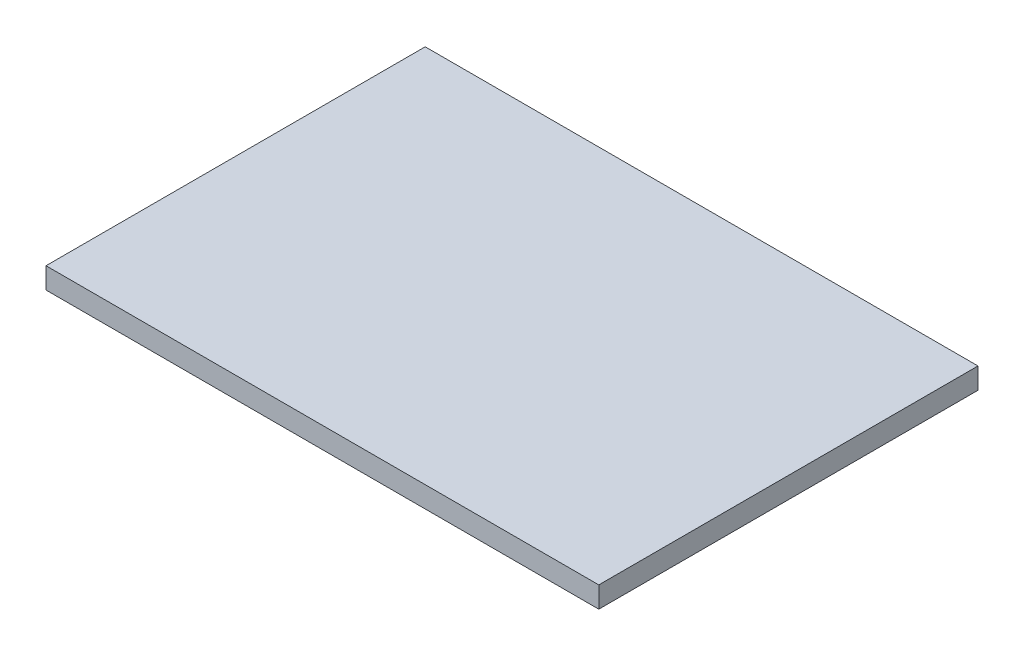
from build123d import *

# Parameters (mm, degrees)
SKETCH2_W           = 131.2
SKETCH2_H           = 90
BOSS_EXTRUDE1_DEPTH = 5


with BuildPart() as part:
    # Sketch2 → Boss-Extrude1 (new body)
    with BuildSketch(Plane(origin=(0, 0, 0), x_dir=(1, 0, 0), z_dir=(0, 1, 0))):
        with Locations((-116.209141946, -16.447842045)):
            Rectangle(SKETCH2_W, SKETCH2_H)
    extrude(amount=BOSS_EXTRUDE1_DEPTH)


solid = part.part
